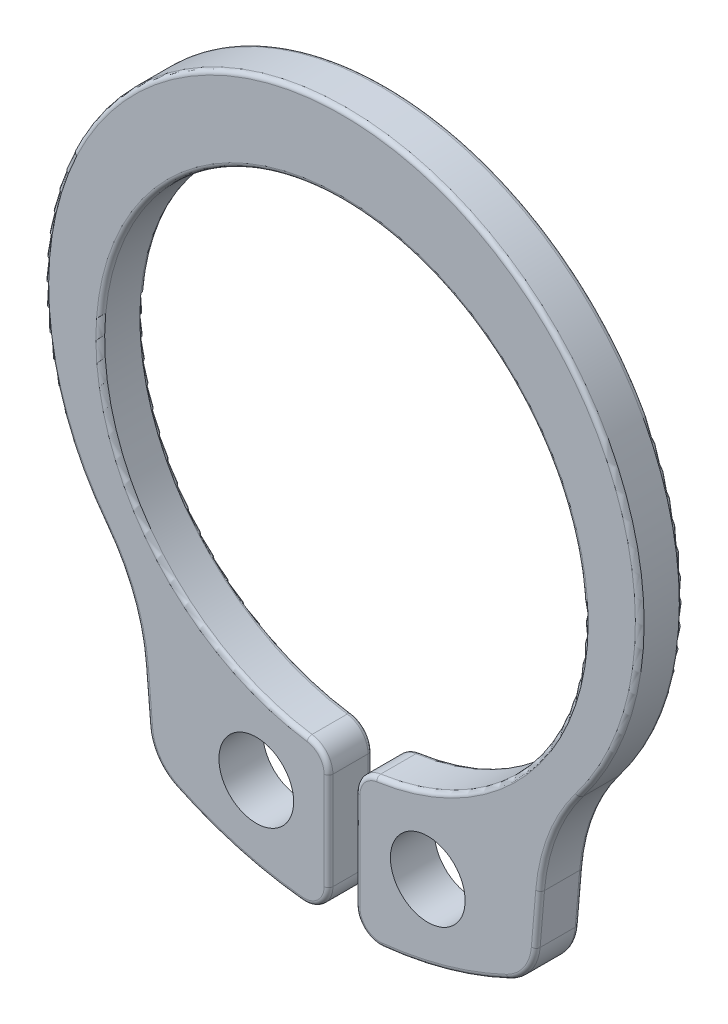
from build123d import *

# Parameters (mm, degrees)
SKETCH2_R           = 0.85
BOSS_EXTRUDE1_DEPTH = 0.5
FILLET1_R           = 4.420105279
FILLET2_R           = 1.10502632
FILLET3_R           = 0.55251316
FILLET4_R           = 0.1


with BuildPart() as part:
    # Sketch2 → Boss-Extrude1 (new, symmetric)
    with BuildSketch(Plane.XY):
        with BuildLine():
            Line((-4.356605307, -7.652086329), (-4.62953307, -4.418984448))
            ThreePointArc((-4.62953307, -4.418984448), (-6.300142319, 3.014912885), (0, 7.3))
            Line((0, 7.3), (0, 5.5))
            ThreePointArc((0, 5.5), (-5.497851653, 0.153711427), (-0.307302772, -5.49140829))
            Line((-0.307302772, -5.49140829), (-0.307302772, -8.8))
            ThreePointArc((-0.307302772, -8.8), (-2.401548686, -8.471540527), (-4.356605307, -7.652086329))
        make_face()
        with Locations((-1.950801133, -6.88151398)):
            Circle(SKETCH2_R, mode=Mode.SUBTRACT)
    extrude(amount=BOSS_EXTRUDE1_DEPTH, both=True)

    # Fillet1
    fillet1_edges = [part.edges().sort_by_distance(p)[0] for p in [
        (-4.62953307, -4.418984448, 0),
    ]]
    fillet(fillet1_edges, radius=FILLET1_R)

    # Fillet2
    fillet2_edges = [part.edges().sort_by_distance(p)[0] for p in [
        (-4.356605307, -7.652086329, 0),
    ]]
    fillet(fillet2_edges, radius=FILLET2_R)

    # Fillet3
    fillet3_edges = [part.edges().sort_by_distance(p)[0] for p in [
        (-0.307302772, -5.49140829, 0),
        (-0.307302772, -8.8, 0),
    ]]
    fillet(fillet3_edges, radius=FILLET3_R)

    # Mirror1: part across plane


with BuildPart() as part_1:
    add(part.part)
    add(part.part.mirror(Plane(origin=(0, 7.3, 0.5), x_dir=(0, 0, 1), z_dir=(-1, 0, 0))))

    # Fillet4
    fillet4_edges = [part_1.edges().sort_by_distance(p)[0] for p in [
        (-4.457046859, -6.462255855, -0.5),
        (-4.457046859, -6.462255855, 0.5),
        (-4.785339351, -4.662481605, -0.5),
        (-4.785339351, -4.662481605, 0.5),
        (-2.383468143, -8.476645245, -0.5),
        (-2.383468143, -8.476645245, 0.5),
        (-4.215071218, -7.583304692, -0.5),
        (-4.215071218, -7.583304692, 0.5),
        (-0.307302772, -7.099534249, -0.5),
        (-0.307302772, -7.099534249, 0.5),
        (5.486037227, 0.391657438, -0.5),
        (-0.442301049, -5.629256388, -0.5),
        (-0.490041388, -8.618472332, -0.5),
        (6.06871565, 3.535525424, 0.5),
        (0, 5.5, 0.5),
        (-0.442301049, -5.629256388, 0.5),
        (-0.490041388, -8.618472332, 0.5),
        (0.307302772, -7.099534249, -0.5),
        (4.457046859, -6.462255855, -0.5),
        (2.383468143, -8.476645245, -0.5),
        (4.457046859, -6.462255855, 0.5),
        (2.383468143, -8.476645245, 0.5),
        (0.307302772, -7.099534249, 0.5),
        (4.785339351, -4.662481605, 0.5),
        (4.785339351, -4.662481605, -0.5),
        (4.215071218, -7.583304692, 0.5),
        (4.215071218, -7.583304692, -0.5),
        (0.490041388, -8.618472332, 0.5),
        (0.490041388, -8.618472332, -0.5),
        (0.442301049, -5.629256388, 0.5),
        (0.442301049, -5.629256388, -0.5),
        (6.06871565, 3.535525424, -0.5),
    ]]
    fillet(fillet4_edges, radius=FILLET4_R)


solid = part_1.part
